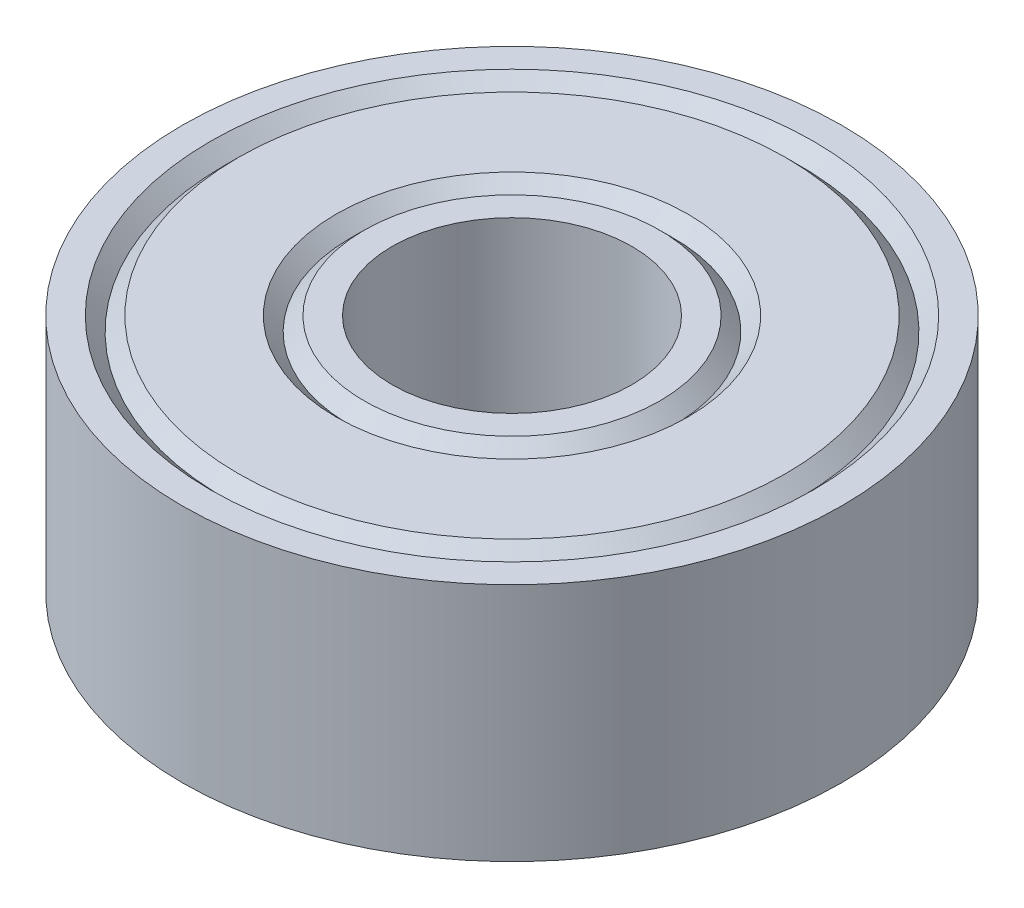
from build123d import *


with BuildPart() as part:
    # Sketch1 → Revolve1 (revolve)
    with BuildSketch(Plane.XY):
        Polygon((-2, 2), (-2.466666667, 2), (-2.7, 1.766666667), (-2.933333333, 2), (-4.566666667, 2), (-4.8, 1.766666667), (-5.033333333, 2), (-5.5, 2), (-5.5, -2), (-5.033333333, -2), (-4.8, -1.766666667), (-4.566666667, -2), (-2.933333333, -2), (-2.7, -1.766666667), (-2.466666667, -2), (-2, -2), align=None)
    revolve(axis=Axis((0, 2, 0), (0, -1, 0)))


solid = part.part
